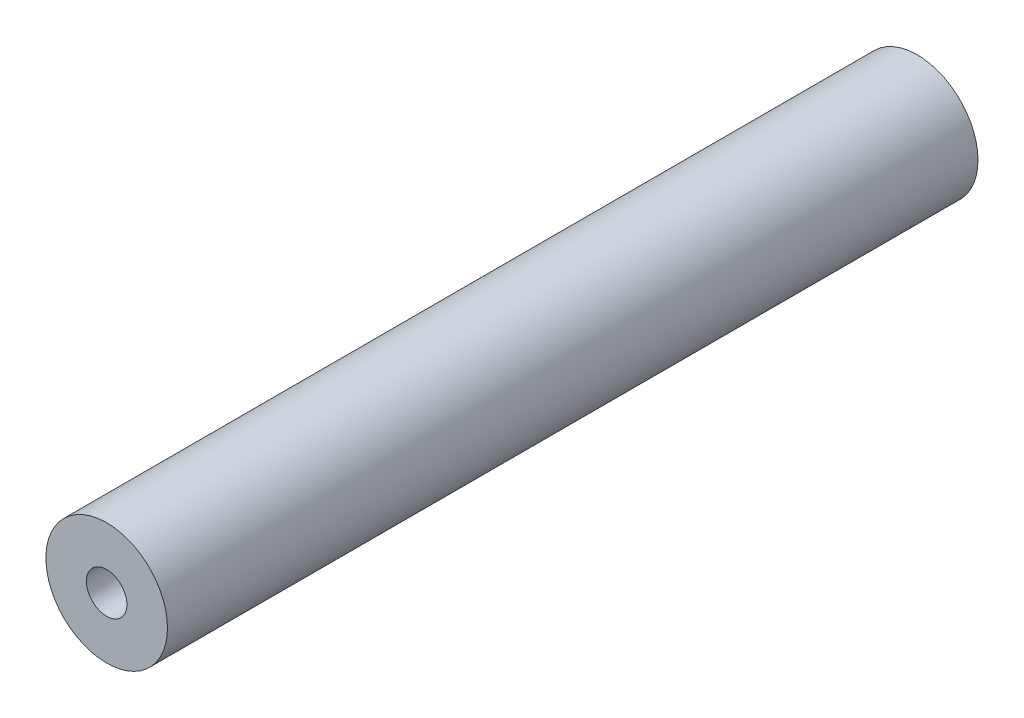
from build123d import *

# Parameters (mm, degrees)
SKETCH1_R           = 4.7625
SKETCH1_R_2         = 1.5875
BOSS_EXTRUDE1_DEPTH = 63.5


with BuildPart() as part:
    # Sketch1 → Boss-Extrude1 (new body)
    with BuildSketch(Plane.XY):
        Circle(SKETCH1_R)
        Circle(SKETCH1_R_2, mode=Mode.SUBTRACT)
    extrude(amount=BOSS_EXTRUDE1_DEPTH)


solid = part.part
